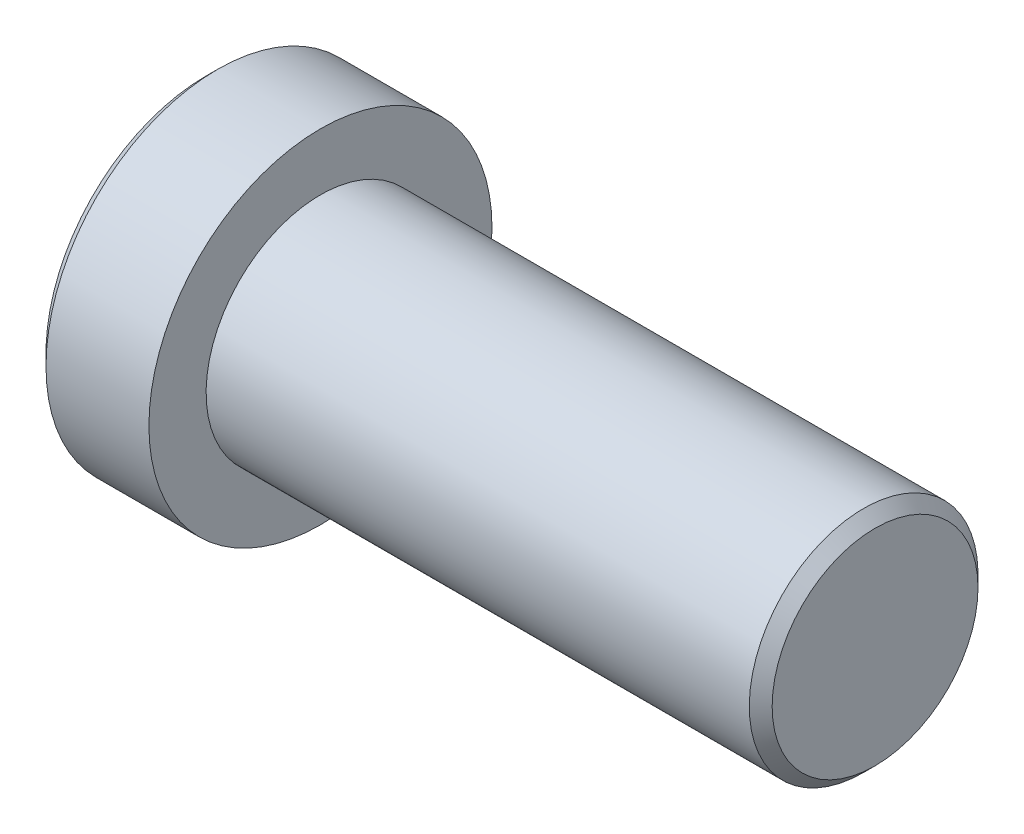
from build123d import *

# Parameters (mm, degrees)
CUT_EXTRUDE1_DEPTH = 1.5
CHAMFER1_SIZE      = 0.2


with BuildPart() as part:
    # Sketch1 → Revolve1 (revolve)
    with BuildSketch(Plane.XY, mode=Mode.PRIVATE) as revolve1_sk:
        Polygon((0, 0), (0, 3), (2, 3), (2, 2), (11.7, 2), (11.7, 0), align=None)
    revolve(revolve1_sk.sketch.rotate(Axis((0, 0, 0), (1, 0, 0)), 180), axis=Axis((0, 0, 0), (1, 0, 0)))

    # Sketch2 → Cut-Extrude1 (cut)
    with BuildSketch(Plane.ZY):
        Polygon((0, 2), (-1.732050808, 1), (-1.732050808, -1), (0, -2), (1.732050808, -1), (1.732050808, 1), align=None)
    extrude(amount=-CUT_EXTRUDE1_DEPTH, mode=Mode.SUBTRACT)

    # Chamfer1
    chamfer1_edges = [part.edges().sort_by_distance(p)[0] for p in [
        (11.7, 2, 0),
        (0, 3, 0),
    ]]
    chamfer(chamfer1_edges, length=CHAMFER1_SIZE)


solid = part.part
